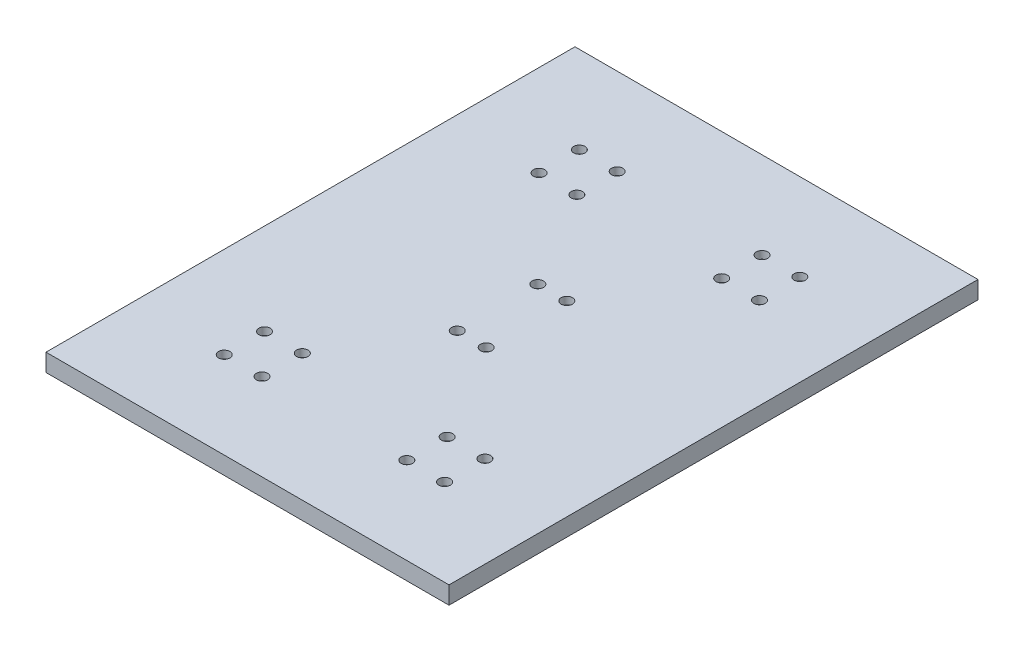
from build123d import *

# Parameters (mm, degrees)
SZKIC1_W                                             = 320
SZKIC1_H                                             = 420
DODANIE_WYCI_GNI_CIE1_DEPTH                          = 14
POG_BIENIE_WALCOWE_POD_M5_WKR_T_DO_CZ_CI_D           = 5.5
POG_BIENIE_WALCOWE_POD_M5_WKR_T_DO_CZ_CI_CBORE_D     = 9
POG_BIENIE_WALCOWE_POD_M5_WKR_T_DO_CZ_CI_CBORE_DEPTH = 6
SZKIC10_W                                            = 70
SZKIC10_H                                            = 4
WYTNIJ_WYCI_GNI_CIE1_DEPTH                           = 50
ZAOKR_GLENIE1_R                                      = 10
SKETCH_1_R                                           = 4.5
CUT_EXTRUDE_1_DEPTH                                  = 6
SKETCH_2_R                                           = 2.75
CUT_EXTRUDE_2_DEPTH                                  = 265.378516525


with BuildPart() as part:
    # Szkic1 → Dodanie-wyciągnięcie1 (new body)
    with BuildSketch(Plane(origin=(0, 0, 0), x_dir=(1, 0, 0), z_dir=(0, 1, 0))):
        Rectangle(SZKIC1_W, SZKIC1_H)
    extrude(amount=DODANIE_WYCI_GNI_CIE1_DEPTH)

    # Pogłębienie walcowe pod M5 Wkręt do części metalowych z łbem sześciokątnym1 (through all)
    with Locations(Plane(origin=(0, 14, 0), x_dir=(1, 0, 0), z_dir=(0, 1, 0))):
        with Locations((-87.5, -141), (-87.5, -109), (-57.5, -141), (-57.5, -109), (57.5, -141), (57.5, -109), (87.5, -109), (87.5, -141)):
            pog_bienie_walcowe_pod_m5_wkr_t_do_cz_ci = CounterBoreHole(POG_BIENIE_WALCOWE_POD_M5_WKR_T_DO_CZ_CI_D / 2, POG_BIENIE_WALCOWE_POD_M5_WKR_T_DO_CZ_CI_CBORE_D / 2, POG_BIENIE_WALCOWE_POD_M5_WKR_T_DO_CZ_CI_CBORE_DEPTH)

    # Lustro3: Pogłębienie walcowe pod M5 Wkręt do części metalowych z łbem sześciokątnym1 across plane
    add(pog_bienie_walcowe_pod_m5_wkr_t_do_cz_ci.mirror(Plane.XY), mode=Mode.SUBTRACT)

    # Szkic10 → Wytnij-wyciągnięcie1 (cut)
    with BuildSketch(Plane.ZY.offset(160)):
        with Locations((0, 2)):
            Rectangle(SZKIC10_W, SZKIC10_H)
    extrude(amount=-WYTNIJ_WYCI_GNI_CIE1_DEPTH, mode=Mode.SUBTRACT)

    # Zaokrąglenie1
    zaokr_glenie1_edges = [part.edges().sort_by_distance(p)[0] for p in [
        (-110, 2, -35),
        (-110, 2, 35),
    ]]
    fillet(zaokr_glenie1_edges, radius=ZAOKR_GLENIE1_R)

    # 草图1 → 切除-拉伸1 (cut)
    with BuildSketch(Plane(origin=(0, 14, 0), x_dir=(1, 0, 0), z_dir=(0, 1, 0))):
        with Locations(Location((11.5, 32, 0), (0, 0, 270))):
            Circle(SKETCH_1_R)
        with Locations(Location((-11.5, 32, 0), (0, 0, 90))):
            Circle(SKETCH_1_R)
        with Locations(Location((-11.5, -32, 0), (0, 0, 270))):
            Circle(SKETCH_1_R)
        with Locations(Location((11.5, -32, 0), (0, 0, 90))):
            Circle(SKETCH_1_R)
    extrude(amount=-CUT_EXTRUDE_1_DEPTH, mode=Mode.SUBTRACT)

    # 草图2 → 切除-拉伸2 (cut, through all)
    with BuildSketch(Plane(origin=(0, 14, 0), x_dir=(1, 0, 0), z_dir=(0, 1, 0))):
        with Locations(Location((11.5, 32, 0), (0, 0, 270))):
            Circle(SKETCH_2_R)
        with Locations(Location((-11.5, 32, 0), (0, 0, 90))):
            Circle(SKETCH_2_R)
        with Locations(Location((-11.5, -32, 0), (0, 0, 270))):
            Circle(SKETCH_2_R)
        with Locations(Location((11.5, -32, 0), (0, 0, 90))):
            Circle(SKETCH_2_R)
    extrude(amount=-CUT_EXTRUDE_2_DEPTH, mode=Mode.SUBTRACT)


solid = part.part
